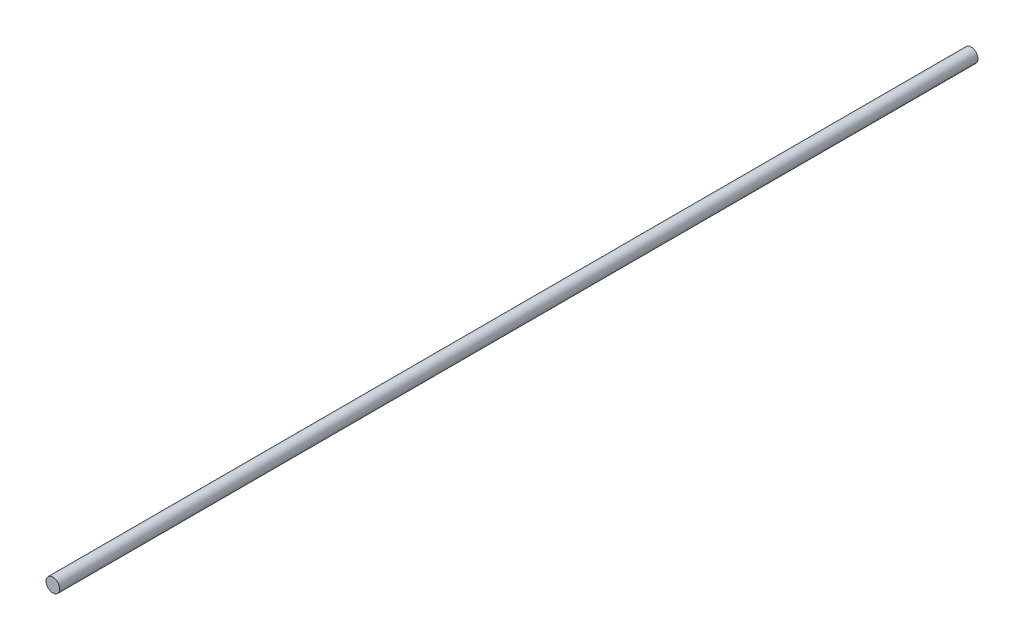
from build123d import *

# Parameters (mm, degrees)
OVEN_YAG_HATTI_D6_START = -240
SKETCH1_R               = 3
OVEN_YAG_HATTI_D6_DEPTH = 400


with BuildPart() as part:
    # Sketch1 → OVEN_yag_hatti_D6 (new body)
    with BuildSketch(Plane.XY.offset(OVEN_YAG_HATTI_D6_START)):
        with Locations((350, 1060)):
            Circle(SKETCH1_R)
    extrude(amount=-OVEN_YAG_HATTI_D6_DEPTH)


solid = part.part
